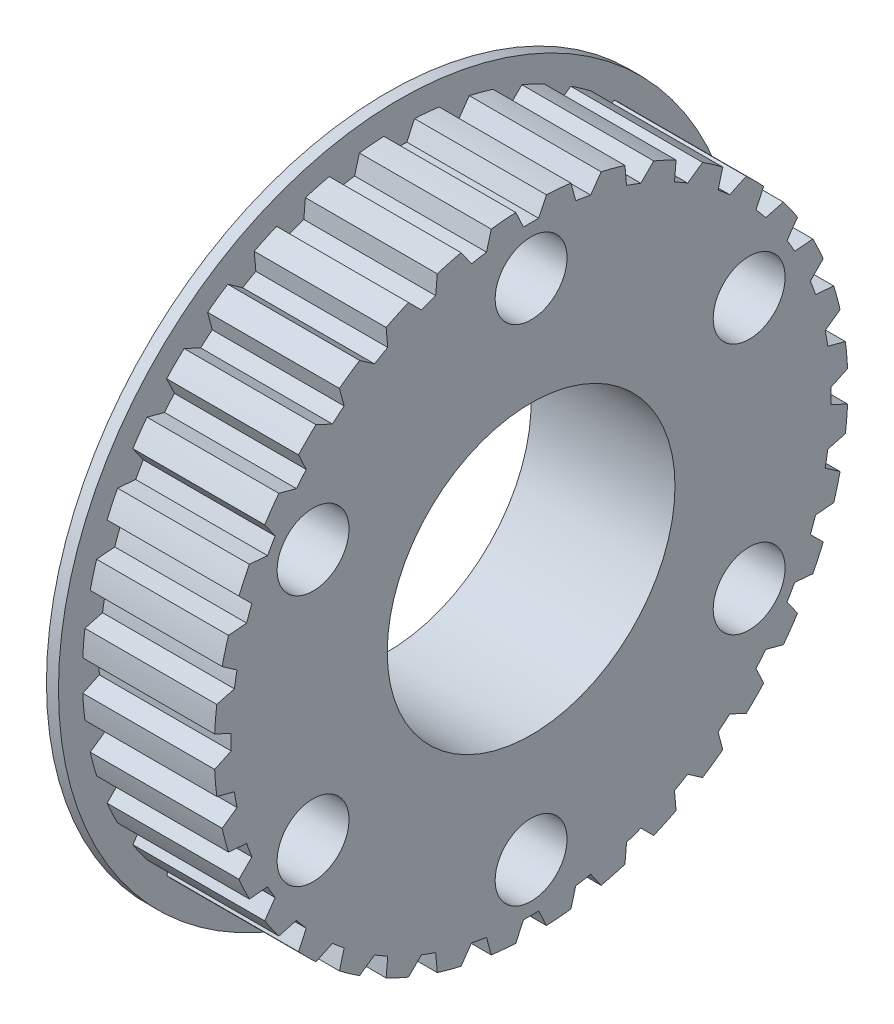
from build123d import *
from build123d.topology import SkipClean

# Parameters (mm, degrees)
SKETCH1_R           = 26.425
SKETCH1_R_2         = 12
BOSS_EXTRUDE1_DEPTH = 11
CUT_EXTRUDE1_DEPTH  = 39.955888515
BOSS_EXTRUDE2_START = 1
SKETCH3_R           = 28.425
SKETCH3_R_2         = 12
BOSS_EXTRUDE2_DEPTH = 1
SKETCH4_R           = 3
CUT_EXTRUDE2_DEPTH  = 42.951892091


with BuildPart() as part:
    # Sketch1 → Boss-Extrude1 (new body)
    with BuildSketch(Plane(origin=(0, 0, 0), x_dir=(0, 0, -1), z_dir=(1, 0, 0))):
        Circle(SKETCH1_R)
        Circle(SKETCH1_R_2, mode=Mode.SUBTRACT)
    extrude(amount=BOSS_EXTRUDE1_DEPTH)

    # Sketch2 → Cut-Extrude1 (cut, through all)
    with BuildSketch(Plane.ZY):
        with BuildLine():
            Line((1.277119753, 26.394120371), (0.634931859, 25.016943989))
            ThreePointArc((0.634931859, 25.016943989), (0, 25.025), (-0.634931859, 25.016943989))
            Line((-0.634931859, 25.016943989), (-1.277119753, 26.394120371))
            ThreePointArc((-1.277119753, 26.394120371), (0, 26.425), (1.277119753, 26.394120371))
        make_face()
        with BuildLine():
            Line((5.841008337, 25.771364857), (4.969432552, 24.526625636))
            ThreePointArc((4.969432552, 24.526625636), (4.345545646, 24.644814019), (3.718860917, 24.747135157))
            Line((3.718860917, 24.747135157), (3.32557347, 26.214903893))
            ThreePointArc((3.32557347, 26.214903893), (4.588653095, 26.023544873), (5.841008337, 25.771364857))
        make_face()
        with BuildLine():
            Line((10.22742084, 24.365559464), (9.152939551, 23.291078175))
            ThreePointArc((9.152939551, 23.291078175), (8.559054087, 23.515807835), (7.959657986, 23.725397146))
            Line((7.959657986, 23.725397146), (7.827220825, 25.239160825))
            ThreePointArc((7.827220825, 25.239160825), (9.037882287, 24.831377504), (10.22742084, 24.365559464))
        make_face()
        with BuildLine():
            Line((14.303078335, 22.219418875), (13.058339114, 21.34784309))
            ThreePointArc((13.058339114, 21.34784309), (12.5125, 21.67228573), (11.958604875, 21.982774949))
            Line((11.958604875, 21.982774949), (12.091042036, 23.496538628))
            ThreePointArc((12.091042036, 23.496538628), (13.2125, 22.884721295), (14.303078335, 22.219418875))
        make_face()
        with BuildLine():
            Line((17.944144032, 19.398152488), (16.566967651, 18.755964594))
            ThreePointArc((16.566967651, 18.755964594), (16.085759932, 19.170262189), (15.594195606, 19.572217258))
            Line((15.594195606, 19.572217258), (15.987483053, 21.039985994))
            ThreePointArc((15.987483053, 21.039985994), (16.985662586, 20.242724409), (17.944144032, 19.398152488))
        make_face()
        with BuildLine():
            Line((21.039985994, 15.987483053), (19.572217258, 15.594195606))
            ThreePointArc((19.572217258, 15.594195606), (19.170262189, 16.085759932), (18.755964594, 16.566967651))
            Line((18.755964594, 16.566967651), (19.398152488, 17.944144032))
            ThreePointArc((19.398152488, 17.944144032), (20.242724409, 16.985662586), (21.039985994, 15.987483053))
        make_face()
        with BuildLine():
            Line((23.496538628, 12.091042036), (21.982774949, 11.958604875))
            ThreePointArc((21.982774949, 11.958604875), (21.67228573, 12.5125), (21.34784309, 13.058339114))
            Line((21.34784309, 13.058339114), (22.219418875, 14.303078335))
            ThreePointArc((22.219418875, 14.303078335), (22.884721295, 13.2125), (23.496538628, 12.091042036))
        make_face()
        with BuildLine():
            Line((25.239160825, 7.827220825), (23.725397146, 7.959657986))
            ThreePointArc((23.725397146, 7.959657986), (23.515807835, 8.559054087), (23.291078175, 9.152939551))
            Line((23.291078175, 9.152939551), (24.365559464, 10.22742084))
            ThreePointArc((24.365559464, 10.22742084), (24.831377504, 9.037882287), (25.239160825, 7.827220825))
        make_face()
        with BuildLine():
            Line((26.214903893, 3.32557347), (24.747135157, 3.718860917))
            ThreePointArc((24.747135157, 3.718860917), (24.644814019, 4.345545646), (24.526625636, 4.969432552))
            Line((24.526625636, 4.969432552), (25.771364857, 5.841008337))
            ThreePointArc((25.771364857, 5.841008337), (26.023544873, 4.588653095), (26.214903893, 3.32557347))
        make_face()
        with BuildLine():
            Line((26.394120371, -1.277119753), (25.016943989, -0.634931859))
            ThreePointArc((25.016943989, -0.634931859), (25.025, 0), (25.016943989, 0.634931859))
            Line((25.016943989, 0.634931859), (26.394120371, 1.277119753))
            ThreePointArc((26.394120371, 1.277119753), (26.425, 0), (26.394120371, -1.277119753))
        make_face()
        with BuildLine():
            Line((25.771364857, -5.841008337), (24.526625636, -4.969432552))
            ThreePointArc((24.526625636, -4.969432552), (24.644814019, -4.345545646), (24.747135157, -3.718860917))
            Line((24.747135157, -3.718860917), (26.214903893, -3.32557347))
            ThreePointArc((26.214903893, -3.32557347), (26.023544873, -4.588653095), (25.771364857, -5.841008337))
        make_face()
        with BuildLine():
            Line((24.365559464, -10.22742084), (23.291078175, -9.152939551))
            ThreePointArc((23.291078175, -9.152939551), (23.515807835, -8.559054087), (23.725397146, -7.959657986))
            Line((23.725397146, -7.959657986), (25.239160825, -7.827220825))
            ThreePointArc((25.239160825, -7.827220825), (24.831377504, -9.037882287), (24.365559464, -10.22742084))
        make_face()
        with BuildLine():
            Line((22.219418875, -14.303078335), (21.34784309, -13.058339114))
            ThreePointArc((21.34784309, -13.058339114), (21.67228573, -12.5125), (21.982774949, -11.958604875))
            Line((21.982774949, -11.958604875), (23.496538628, -12.091042036))
            ThreePointArc((23.496538628, -12.091042036), (22.884721295, -13.2125), (22.219418875, -14.303078335))
        make_face()
        with BuildLine():
            Line((19.398152488, -17.944144032), (18.755964594, -16.566967651))
            ThreePointArc((18.755964594, -16.566967651), (19.170262189, -16.085759932), (19.572217258, -15.594195606))
            Line((19.572217258, -15.594195606), (21.039985994, -15.987483053))
            ThreePointArc((21.039985994, -15.987483053), (20.242724409, -16.985662586), (19.398152488, -17.944144032))
        make_face()
        with BuildLine():
            Line((15.987483053, -21.039985994), (15.594195606, -19.572217258))
            ThreePointArc((15.594195606, -19.572217258), (16.085759932, -19.170262189), (16.566967651, -18.755964594))
            Line((16.566967651, -18.755964594), (17.944144032, -19.398152488))
            ThreePointArc((17.944144032, -19.398152488), (16.985662586, -20.242724409), (15.987483053, -21.039985994))
        make_face()
        with BuildLine():
            Line((12.091042036, -23.496538628), (11.958604875, -21.982774949))
            ThreePointArc((11.958604875, -21.982774949), (12.5125, -21.67228573), (13.058339114, -21.34784309))
            Line((13.058339114, -21.34784309), (14.303078335, -22.219418875))
            ThreePointArc((14.303078335, -22.219418875), (13.2125, -22.884721295), (12.091042036, -23.496538628))
        make_face()
        with BuildLine():
            Line((7.827220825, -25.239160825), (7.959657986, -23.725397146))
            ThreePointArc((7.959657986, -23.725397146), (8.559054087, -23.515807835), (9.152939551, -23.291078175))
            Line((9.152939551, -23.291078175), (10.22742084, -24.365559464))
            ThreePointArc((10.22742084, -24.365559464), (9.037882287, -24.831377504), (7.827220825, -25.239160825))
        make_face()
        with BuildLine():
            Line((3.32557347, -26.214903893), (3.718860917, -24.747135157))
            ThreePointArc((3.718860917, -24.747135157), (4.345545646, -24.644814019), (4.969432552, -24.526625636))
            Line((4.969432552, -24.526625636), (5.841008337, -25.771364857))
            ThreePointArc((5.841008337, -25.771364857), (4.588653095, -26.023544873), (3.32557347, -26.214903893))
        make_face()
        with BuildLine():
            Line((-1.277119753, -26.394120371), (-0.634931859, -25.016943989))
            ThreePointArc((-0.634931859, -25.016943989), (0, -25.025), (0.634931859, -25.016943989))
            Line((0.634931859, -25.016943989), (1.277119753, -26.394120371))
            ThreePointArc((1.277119753, -26.394120371), (0, -26.425), (-1.277119753, -26.394120371))
        make_face()
        with BuildLine():
            Line((-5.841008337, -25.771364857), (-4.969432552, -24.526625636))
            ThreePointArc((-4.969432552, -24.526625636), (-4.345545646, -24.644814019), (-3.718860917, -24.747135157))
            Line((-3.718860917, -24.747135157), (-3.32557347, -26.214903893))
            ThreePointArc((-3.32557347, -26.214903893), (-4.588653095, -26.023544873), (-5.841008337, -25.771364857))
        make_face()
        with BuildLine():
            Line((-10.22742084, -24.365559464), (-9.152939551, -23.291078175))
            ThreePointArc((-9.152939551, -23.291078175), (-8.559054087, -23.515807835), (-7.959657986, -23.725397146))
            Line((-7.959657986, -23.725397146), (-7.827220825, -25.239160825))
            ThreePointArc((-7.827220825, -25.239160825), (-9.037882287, -24.831377504), (-10.22742084, -24.365559464))
        make_face()
        with BuildLine():
            Line((-14.303078335, -22.219418875), (-13.058339114, -21.34784309))
            ThreePointArc((-13.058339114, -21.34784309), (-12.5125, -21.67228573), (-11.958604875, -21.982774949))
            Line((-11.958604875, -21.982774949), (-12.091042036, -23.496538628))
            ThreePointArc((-12.091042036, -23.496538628), (-13.2125, -22.884721295), (-14.303078335, -22.219418875))
        make_face()
        with BuildLine():
            Line((-17.944144032, -19.398152488), (-16.566967651, -18.755964594))
            ThreePointArc((-16.566967651, -18.755964594), (-16.085759932, -19.170262189), (-15.594195606, -19.572217258))
            Line((-15.594195606, -19.572217258), (-15.987483053, -21.039985994))
            ThreePointArc((-15.987483053, -21.039985994), (-16.985662586, -20.242724409), (-17.944144032, -19.398152488))
        make_face()
        with BuildLine():
            Line((-21.039985994, -15.987483053), (-19.572217258, -15.594195606))
            ThreePointArc((-19.572217258, -15.594195606), (-19.170262189, -16.085759932), (-18.755964594, -16.566967651))
            Line((-18.755964594, -16.566967651), (-19.398152488, -17.944144032))
            ThreePointArc((-19.398152488, -17.944144032), (-20.242724409, -16.985662586), (-21.039985994, -15.987483053))
        make_face()
        with BuildLine():
            Line((-23.496538628, -12.091042036), (-21.982774949, -11.958604875))
            ThreePointArc((-21.982774949, -11.958604875), (-21.67228573, -12.5125), (-21.34784309, -13.058339114))
            Line((-21.34784309, -13.058339114), (-22.219418875, -14.303078335))
            ThreePointArc((-22.219418875, -14.303078335), (-22.884721295, -13.2125), (-23.496538628, -12.091042036))
        make_face()
        with BuildLine():
            Line((-25.239160825, -7.827220825), (-23.725397146, -7.959657986))
            ThreePointArc((-23.725397146, -7.959657986), (-23.515807835, -8.559054087), (-23.291078175, -9.152939551))
            Line((-23.291078175, -9.152939551), (-24.365559464, -10.22742084))
            ThreePointArc((-24.365559464, -10.22742084), (-24.831377504, -9.037882287), (-25.239160825, -7.827220825))
        make_face()
        with BuildLine():
            Line((-26.214903893, -3.32557347), (-24.747135157, -3.718860917))
            ThreePointArc((-24.747135157, -3.718860917), (-24.644814019, -4.345545646), (-24.526625636, -4.969432552))
            Line((-24.526625636, -4.969432552), (-25.771364857, -5.841008337))
            ThreePointArc((-25.771364857, -5.841008337), (-26.023544873, -4.588653095), (-26.214903893, -3.32557347))
        make_face()
        with BuildLine():
            Line((-26.394120371, 1.277119753), (-25.016943989, 0.634931859))
            ThreePointArc((-25.016943989, 0.634931859), (-25.025, 0), (-25.016943989, -0.634931859))
            Line((-25.016943989, -0.634931859), (-26.394120371, -1.277119753))
            ThreePointArc((-26.394120371, -1.277119753), (-26.425, 0), (-26.394120371, 1.277119753))
        make_face()
        with BuildLine():
            Line((-25.771364857, 5.841008337), (-24.526625636, 4.969432552))
            ThreePointArc((-24.526625636, 4.969432552), (-24.644814019, 4.345545646), (-24.747135157, 3.718860917))
            Line((-24.747135157, 3.718860917), (-26.214903893, 3.32557347))
            ThreePointArc((-26.214903893, 3.32557347), (-26.023544873, 4.588653095), (-25.771364857, 5.841008337))
        make_face()
        with BuildLine():
            Line((-24.365559464, 10.22742084), (-23.291078175, 9.152939551))
            ThreePointArc((-23.291078175, 9.152939551), (-23.515807835, 8.559054087), (-23.725397146, 7.959657986))
            Line((-23.725397146, 7.959657986), (-25.239160825, 7.827220825))
            ThreePointArc((-25.239160825, 7.827220825), (-24.831377504, 9.037882287), (-24.365559464, 10.22742084))
        make_face()
        with BuildLine():
            Line((-22.219418875, 14.303078335), (-21.34784309, 13.058339114))
            ThreePointArc((-21.34784309, 13.058339114), (-21.67228573, 12.5125), (-21.982774949, 11.958604875))
            Line((-21.982774949, 11.958604875), (-23.496538628, 12.091042036))
            ThreePointArc((-23.496538628, 12.091042036), (-22.884721295, 13.2125), (-22.219418875, 14.303078335))
        make_face()
        with BuildLine():
            Line((-19.398152488, 17.944144032), (-18.755964594, 16.566967651))
            ThreePointArc((-18.755964594, 16.566967651), (-19.170262189, 16.085759932), (-19.572217258, 15.594195606))
            Line((-19.572217258, 15.594195606), (-21.039985994, 15.987483053))
            ThreePointArc((-21.039985994, 15.987483053), (-20.242724409, 16.985662586), (-19.398152488, 17.944144032))
        make_face()
        with BuildLine():
            Line((-15.987483053, 21.039985994), (-15.594195606, 19.572217258))
            ThreePointArc((-15.594195606, 19.572217258), (-16.085759932, 19.170262189), (-16.566967651, 18.755964594))
            Line((-16.566967651, 18.755964594), (-17.944144032, 19.398152488))
            ThreePointArc((-17.944144032, 19.398152488), (-16.985662586, 20.242724409), (-15.987483053, 21.039985994))
        make_face()
        with BuildLine():
            Line((-12.091042036, 23.496538628), (-11.958604875, 21.982774949))
            ThreePointArc((-11.958604875, 21.982774949), (-12.5125, 21.67228573), (-13.058339114, 21.34784309))
            Line((-13.058339114, 21.34784309), (-14.303078335, 22.219418875))
            ThreePointArc((-14.303078335, 22.219418875), (-13.2125, 22.884721295), (-12.091042036, 23.496538628))
        make_face()
        with BuildLine():
            Line((-7.827220825, 25.239160825), (-7.959657986, 23.725397146))
            ThreePointArc((-7.959657986, 23.725397146), (-8.559054087, 23.515807835), (-9.152939551, 23.291078175))
            Line((-9.152939551, 23.291078175), (-10.22742084, 24.365559464))
            ThreePointArc((-10.22742084, 24.365559464), (-9.037882287, 24.831377504), (-7.827220825, 25.239160825))
        make_face()
        with BuildLine():
            Line((-3.32557347, 26.214903893), (-3.718860917, 24.747135157))
            ThreePointArc((-3.718860917, 24.747135157), (-4.345545646, 24.644814019), (-4.969432552, 24.526625636))
            Line((-4.969432552, 24.526625636), (-5.841008337, 25.771364857))
            ThreePointArc((-5.841008337, 25.771364857), (-4.588653095, 26.023544873), (-3.32557347, 26.214903893))
        make_face()
    extrude(amount=-CUT_EXTRUDE1_DEPTH, mode=Mode.SUBTRACT)

    # Sketch3 → Boss-Extrude2 (add)
    with SkipClean():  # the faces are left unmerged after this step: merging them gives an invalid solid
        with BuildSketch(Plane.ZY.offset(BOSS_EXTRUDE2_START)):
            Circle(SKETCH3_R)
            Circle(SKETCH3_R_2, mode=Mode.SUBTRACT)
        extrude(amount=-BOSS_EXTRUDE2_DEPTH)

    # Sketch4 → Cut-Extrude2 (cut, through all)
    with SkipClean():  # the faces are left unmerged after this step: merging them gives an invalid solid
        with BuildSketch(Plane.ZY.offset(1)):
            with Locations((0, 21)):
                Circle(SKETCH4_R)
            with Locations((18.186533479, 10.5)):
                Circle(SKETCH4_R)
            with Locations((18.186533479, -10.5)):
                Circle(SKETCH4_R)
            with Locations((0, -21)):
                Circle(SKETCH4_R)
            with Locations((-18.186533479, -10.5)):
                Circle(SKETCH4_R)
            with Locations((-18.186533479, 10.5)):
                Circle(SKETCH4_R)
        extrude(amount=-CUT_EXTRUDE2_DEPTH, mode=Mode.SUBTRACT)


solid = part.part
